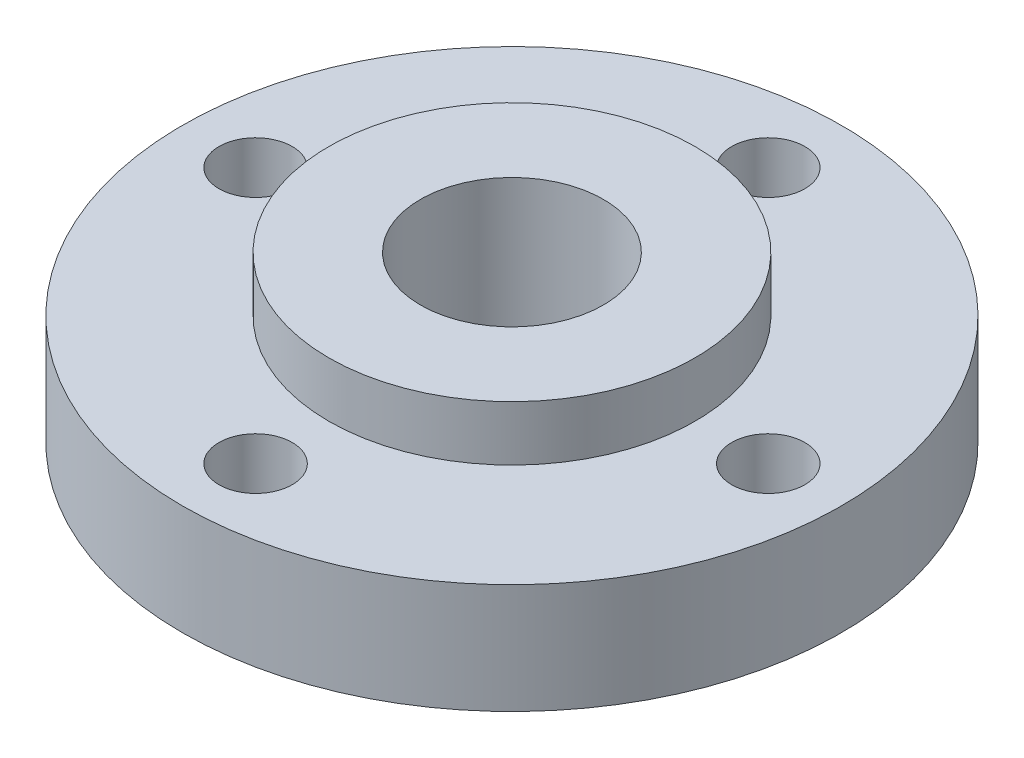
from build123d import *

# Parameters (mm, degrees)
SKETCH1_R           = 36
SKETCH1_R_2         = 10
BOSS_EXTRUDE1_DEPTH = 12
SKETCH2_R           = 20
SKETCH2_R_2         = 10
BOSS_EXTRUDE2_DEPTH = 6
CUT_EXTRUDE1_REACH  = 54.307
SKETCH3_R           = 4


with BuildPart() as part:
    # Sketch1 → Boss-Extrude1 (new body)
    with BuildSketch(Plane(origin=(0, 0, 0), x_dir=(1, 0, 0), z_dir=(0, 1, 0))):
        with Locations(Location((0, 0, 0), (0, 0, 270))):
            Circle(SKETCH1_R)
        with Locations(Location((0, 0, 0), (0, 0, 270))):
            Circle(SKETCH1_R_2, mode=Mode.SUBTRACT)
    extrude(amount=BOSS_EXTRUDE1_DEPTH)

    # Sketch2 → Boss-Extrude2 (add)
    with BuildSketch(Plane(origin=(0, 12, 0), x_dir=(1, 0, 0), z_dir=(0, 1, 0))):
        with Locations(Location((0, 0, 0), (0, 0, 270))):
            Circle(SKETCH2_R)
        with Locations(Location((0, 0, 0), (0, 0, 270))):
            Circle(SKETCH2_R_2, mode=Mode.SUBTRACT)
    extrude(amount=BOSS_EXTRUDE2_DEPTH)

    # Sketch3 → Cut-Extrude1 (cut, up to next)
    with BuildSketch(Plane(origin=(0, 12, 0), x_dir=(1, 0, 0), z_dir=(0, 1, 0)), mode=Mode.PRIVATE) as cut_extrude1_sk1:
        with Locations(Location((0, -28, 0), (0, 0, 270))):
            Circle(SKETCH3_R)
    cut_extrude1_tool1 = extrude(cut_extrude1_sk1.sketch, amount=-CUT_EXTRUDE1_REACH, mode=Mode.PRIVATE) & part.part
    # Sketch3 → Cut-Extrude1 (cut, up to next)
    with BuildSketch(Plane(origin=(0, 12, 0), x_dir=(1, 0, 0), z_dir=(0, 1, 0)), mode=Mode.PRIVATE) as cut_extrude1_sk2:
        with Locations(Location((-28, 0, 0), (0, 0, 270))):
            Circle(SKETCH3_R)
    cut_extrude1_tool2 = extrude(cut_extrude1_sk2.sketch, amount=-CUT_EXTRUDE1_REACH, mode=Mode.PRIVATE) & part.part
    # Sketch3 → Cut-Extrude1 (cut, up to next)
    with BuildSketch(Plane(origin=(0, 12, 0), x_dir=(1, 0, 0), z_dir=(0, 1, 0)), mode=Mode.PRIVATE) as cut_extrude1_sk3:
        with Locations(Location((0, 28, 0), (0, 0, 270))):
            Circle(SKETCH3_R)
    cut_extrude1_tool3 = extrude(cut_extrude1_sk3.sketch, amount=-CUT_EXTRUDE1_REACH, mode=Mode.PRIVATE) & part.part
    # Sketch3 → Cut-Extrude1 (cut, up to next)
    with BuildSketch(Plane(origin=(0, 12, 0), x_dir=(1, 0, 0), z_dir=(0, 1, 0)), mode=Mode.PRIVATE) as cut_extrude1_sk4:
        with Locations(Location((28, 0, 0), (0, 0, 270))):
            Circle(SKETCH3_R)
    cut_extrude1_tool4 = extrude(cut_extrude1_sk4.sketch, amount=-CUT_EXTRUDE1_REACH, mode=Mode.PRIVATE) & part.part
    add(cut_extrude1_tool1.solids().sort_by_distance((0, 12, 28))[0], mode=Mode.SUBTRACT)
    add(cut_extrude1_tool2.solids().sort_by_distance((-28, 12, 0))[0], mode=Mode.SUBTRACT)
    add(cut_extrude1_tool3.solids().sort_by_distance((0, 12, -28))[0], mode=Mode.SUBTRACT)
    add(cut_extrude1_tool4.solids().sort_by_distance((28, 12, 0))[0], mode=Mode.SUBTRACT)


solid = part.part
